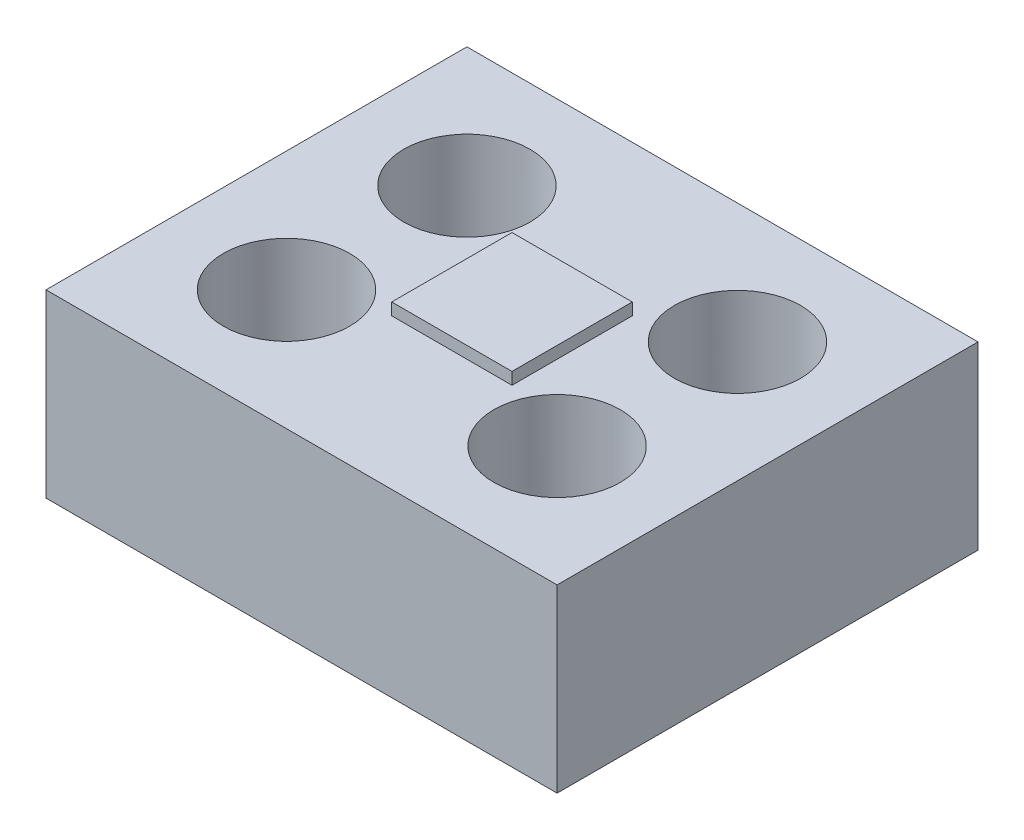
from build123d import *

# Parameters (mm, degrees)
SKETCH1_W               = 850
SKETCH1_H               = 700
SKETCH1_R               = 105
BOSS_EXTRUDE1_DEPTH     = 300
SKETCH2_W               = 718.724675112
SKETCH2_H               = 607.354725455
BOSS_EXTRUDE2_DEPTH     = 100
SKETCH3_R               = 30
BOSS_EXTRUDE3_DEPTH     = 10
CUT_EXTRUDE1_START      = -325
SKETCH4_R               = 141
CUT_EXTRUDE1_DEPTH      = 200
CUT_EXTRUDE2_DEPTH      = 220
CUT_EXTRUDE2_DEPTH_BACK = 20
SKETCH5_R               = 50
SKETCH6_W               = 200
SKETCH6_H               = 200
BOSS_EXTRUDE4_DEPTH     = 20


with BuildPart() as part:
    # Sketch1 → Boss-Extrude1 (new body)
    with BuildSketch(Plane(origin=(0, 0, 0), x_dir=(1, 0, 0), z_dir=(0, 1, 0))):
        Rectangle(SKETCH1_W, SKETCH1_H)
        with Locations(Location((-225, 150, 0), (0, 0, 270))):
            Circle(SKETCH1_R, mode=Mode.SUBTRACT)
        with Locations(Location((225, 150, 0), (0, 0, 270))):
            Circle(SKETCH1_R, mode=Mode.SUBTRACT)
        with Locations(Location((-225, -150, 0), (0, 0, 270))):
            Circle(SKETCH1_R, mode=Mode.SUBTRACT)
        with Locations(Location((225, -150, 0), (0, 0, 270))):
            Circle(SKETCH1_R, mode=Mode.SUBTRACT)
    extrude(amount=BOSS_EXTRUDE1_DEPTH)

    # Sketch2 → Boss-Extrude2 (add)
    with BuildSketch(Plane.XZ):
        with Locations((3.884998244, -5.179997659)):
            Rectangle(SKETCH2_W, SKETCH2_H)
    extrude(amount=-BOSS_EXTRUDE2_DEPTH)

    # Sketch3 → Boss-Extrude3 (add)
    with BuildSketch(Plane(origin=(0, 100, 0), x_dir=(1, 0, 0), z_dir=(0, 1, 0))):
        with Locations(Location((-225, 150, 0), (0, 0, 90))):
            Circle(SKETCH3_R)
        with Locations(Location((225, 150, 0), (0, 0, 90))):
            Circle(SKETCH3_R)
        with Locations(Location((225, -150, 0), (0, 0, 90))):
            Circle(SKETCH3_R)
        with Locations(Location((-225, -150, 0), (0, 0, 90))):
            Circle(SKETCH3_R)
    extrude(amount=BOSS_EXTRUDE3_DEPTH)

    # Sketch4 → Cut-Extrude1 (cut)
    with BuildSketch(Plane.ZY.offset(425).offset(CUT_EXTRUDE1_START)):
        with Locations((0, 150)):
            Circle(SKETCH4_R)
    extrude(amount=-CUT_EXTRUDE1_DEPTH, mode=Mode.SUBTRACT)

    # Sketch5 → Cut-Extrude2 (cut, two sides: drawn at the far end of the back side and taken through both)
    with BuildSketch(Plane.ZY.offset(-100).offset(-CUT_EXTRUDE2_DEPTH_BACK)):
        with Locations((0, 150)):
            Circle(SKETCH5_R)
    extrude(amount=CUT_EXTRUDE2_DEPTH + CUT_EXTRUDE2_DEPTH_BACK, mode=Mode.SUBTRACT)

    # Sketch6 → Boss-Extrude4 (add)
    with BuildSketch(Plane(origin=(0, 300, 0), x_dir=(1, 0, 0), z_dir=(0, 1, 0))):
        Rectangle(SKETCH6_W, SKETCH6_H)
    extrude(amount=BOSS_EXTRUDE4_DEPTH)


solid = part.part
